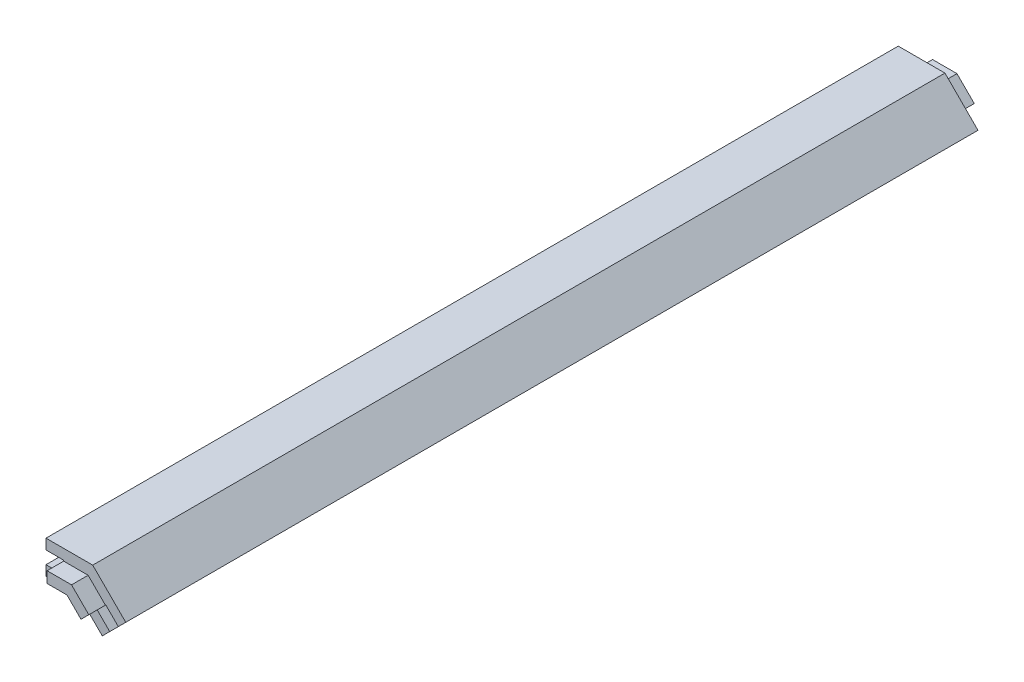
from build123d import *

# Parameters (mm, degrees)
BOSS_EXTRUDE1_DEPTH = 7.5
BOSS_EXTRUDE2_DEPTH = 385
BOSS_EXTRUDE3_DEPTH = 7.5


with BuildPart() as part:
    # Sketch1 → Boss-Extrude1 (new body)
    with BuildSketch(Plane.XY):
        Polygon((0, -2.5), (8.964466094, -2.5), (15.303300859, -8.838834765), (18.838834765, -5.303300859), (11.035533906, 2.5), (0, 2.5), align=None)
    extrude(amount=BOSS_EXTRUDE1_DEPTH)

    # Sketch2 → Boss-Extrude2 (add)
    with BuildSketch(Plane.XY.offset(7.5)):
        Polygon((15.126524164, -9.01561146), (20.783378413, -14.67246571), (17.424621202, -18.03122292), (6.893398282, -7.5), (-8, -7.5), (-8, -2.875), (0, -2.875), (0, 2.875), (-8, 2.875), (-8, 7.5), (13.106601718, 7.5), (28.03122292, -7.424621202), (24.67246571, -10.783378413), (19.01561146, -5.126524164), align=None)
    extrude(amount=BOSS_EXTRUDE2_DEPTH)

    # Sketch4 → Boss-Extrude3 (add)
    with BuildSketch(Plane.XY.offset(392.5)):
        Polygon((15.303300859, -8.838834765), (18.838834765, -5.303300859), (11.035533906, 2.5), (0, 2.5), (0, -2.5), (8.964466094, -2.5), align=None)
    extrude(amount=BOSS_EXTRUDE3_DEPTH)


solid = part.part
